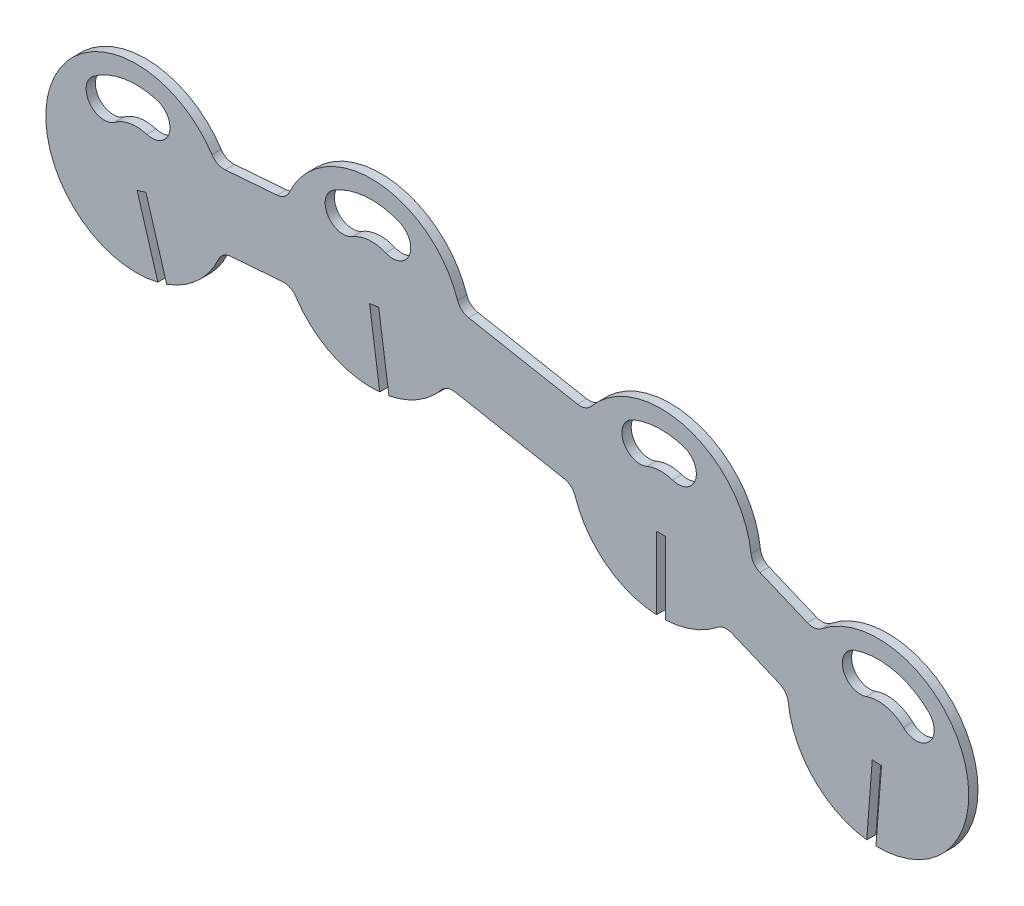
from build123d import *

# Parameters (mm, degrees)
BOSS_EXTRUDE1_DEPTH = 0.8128


with BuildPart() as part:
    # Sketch4 → Boss-Extrude1 (new body)
    with BuildSketch(Plane.XY):
        with BuildLine():
            ThreePointArc((93.949424924, 80.553749396), (79.926578404, 79.107244128), (89.201071756, 68.490447291))
            Line((89.201071756, 68.490447291), (87.379404166, 74.562672592))
            Line((87.379404166, 74.562672592), (87.768664768, 74.679450772))
            Line((87.768664768, 74.679450772), (88.157925371, 74.796228953))
            Line((88.157925371, 74.796228953), (89.979592961, 68.724003652))
            ThreePointArc((89.979592961, 68.724003652), (92.683522719, 70.35568471), (94.537210983, 72.912530234))
            ThreePointArc((94.537210983, 72.912530234), (94.965343033, 73.427292247), (95.595760228, 73.652794227))
            Line((95.595760228, 73.652794227), (100.153762821, 74.003409811))
            ThreePointArc((100.153762821, 74.003409811), (100.811251698, 73.876977473), (101.313075076, 73.433750604))
            ThreePointArc((101.313075076, 73.433750604), (104.499077144, 70.639420699), (108.66874425, 69.88260829))
            Line((108.66874425, 69.88260829), (107.772190929, 76.15848154))
            Line((107.772190929, 76.15848154), (108.174506403, 76.215955179))
            Line((108.174506403, 76.215955179), (108.576821877, 76.273428818))
            Line((108.576821877, 76.273428818), (109.473375199, 69.997555568))
            ThreePointArc((109.473375199, 69.997555568), (112.013123253, 70.968780496), (114.076058013, 72.740191859))
            ThreePointArc((114.076058013, 72.740191859), (114.622955908, 73.126429859), (115.290273938, 73.180870175))
            Line((115.290273938, 73.180870175), (124.839494012, 71.390391411))
            ThreePointArc((124.839494012, 71.390391411), (125.441762928, 71.097903494), (125.811592802, 70.539779051))
            ThreePointArc((125.811592802, 70.539779051), (128.535078066, 66.714656664), (132.9436, 65.097910667))
            Line((132.9436, 65.097910667), (132.9436, 71.447910667))
            Line((132.9436, 71.447910667), (133.35, 71.447910667))
            Line((133.35, 71.447910667), (133.7564, 71.447910667))
            Line((133.7564, 71.447910667), (133.7564, 65.097910667))
            ThreePointArc((133.7564, 65.097910667), (136.15889652, 65.601119169), (138.292771811, 66.814290453))
            ThreePointArc((138.292771811, 66.814290453), (138.908022168, 67.078379412), (139.572075423, 66.99288524))
            Line((139.572075423, 66.99288524), (143.735615445, 65.258076898))
            ThreePointArc((143.735615445, 65.258076898), (144.263910207, 64.846759758), (144.509615464, 64.223938699))
            ThreePointArc((144.509615464, 64.223938699), (146.734319899, 59.528365603), (151.386817059, 57.214929481))
            Line((151.386817059, 57.214929481), (151.873839827, 63.546225464))
            Line((151.873839827, 63.546225464), (152.27904277, 63.515056007))
            Line((152.27904277, 63.515056007), (152.684245713, 63.48388655))
            Line((152.684245713, 63.48388655), (152.197222945, 57.152590567))
            ThreePointArc((152.197222945, 57.152590567), (159.92620767, 67.609424733), (147.457228033, 71.298209423))
            ThreePointArc((147.457228033, 71.298209423), (146.84197711, 71.034120487), (146.177923414, 71.119615244))
            Line((146.177923414, 71.119615244), (142.014384371, 72.854423179))
            ThreePointArc((142.014384371, 72.854423179), (141.486089803, 73.265740229), (141.240384561, 73.888561071))
            ThreePointArc((141.240384561, 73.888561071), (135.620274674, 80.630902915), (127.223942036, 78.0723082))
            ThreePointArc((127.223942036, 78.0723082), (126.677044199, 77.68607018), (126.009726211, 77.631629797))
            Line((126.009726211, 77.631629797), (116.460505988, 79.422108589))
            ThreePointArc((116.460505988, 79.422108589), (115.858237072, 79.714596506), (115.488407198, 80.272720949))
            ThreePointArc((115.488407198, 80.272720949), (108.380699585, 85.713306212), (100.725289029, 81.074969792))
            ThreePointArc((100.725289029, 81.074969792), (100.297156978, 80.560207761), (99.666739772, 80.334705773))
            Line((99.666739772, 80.334705773), (95.108737382, 79.984090204))
            ThreePointArc((95.108737382, 79.984090204), (94.451248393, 80.110522482), (93.949424924, 80.553749396))
        make_face()
        with BuildLine():
            ThreePointArc((156.824589095, 69.642224068), (156.857122838, 67.397395778), (154.612294548, 67.364862034))
            ThreePointArc((154.612294548, 67.364862034), (153.086943568, 68.187295725), (151.356947016, 68.08627733))
            ThreePointArc((151.356947016, 68.08627733), (149.336031859, 69.064139502), (150.313894032, 71.085054659))
            ThreePointArc((150.313894032, 71.085054659), (153.773887136, 71.287091449), (156.824589095, 69.642224068))
        make_face(mode=Mode.SUBTRACT)
        with BuildLine():
            ThreePointArc((88.224829537, 79.241098456), (86.773324607, 79.32888397), (85.434920368, 78.760335862))
            ThreePointArc((85.434920368, 78.760335862), (83.215962621, 79.101713977), (83.557340736, 81.320671724))
            ThreePointArc((83.557340736, 81.320671724), (86.234149214, 82.457767939), (89.137159073, 82.282196911))
            ThreePointArc((89.137159073, 82.282196911), (90.201543533, 80.305482915), (88.224829537, 79.241098456))
        make_face(mode=Mode.SUBTRACT)
        with BuildLine():
            ThreePointArc((106.29439622, 80.496669822), (104.112009419, 81.023452843), (104.63879244, 83.205839644))
            ThreePointArc((104.63879244, 83.205839644), (107.474111012, 84.119642581), (110.41416195, 83.639884632))
            ThreePointArc((110.41416195, 83.639884632), (111.261217621, 81.560747987), (109.182080975, 80.713692316))
            ThreePointArc((109.182080975, 80.713692316), (107.712055506, 80.953571291), (106.29439622, 80.496669822))
        make_face(mode=Mode.SUBTRACT)
        with BuildLine():
            ThreePointArc((132.117919025, 75.951192316), (130.038782379, 76.798247987), (130.88583805, 78.877384632))
            ThreePointArc((130.88583805, 78.877384632), (133.106309101, 79.370322273), (135.358046314, 79.049138943))
            ThreePointArc((135.358046314, 79.049138943), (136.362069471, 77.041092628), (134.354023157, 76.037069471))
            ThreePointArc((134.354023157, 76.037069471), (133.228154551, 76.197661136), (132.117919025, 75.951192316))
        make_face(mode=Mode.SUBTRACT)
    extrude(amount=BOSS_EXTRUDE1_DEPTH)


solid = part.part
